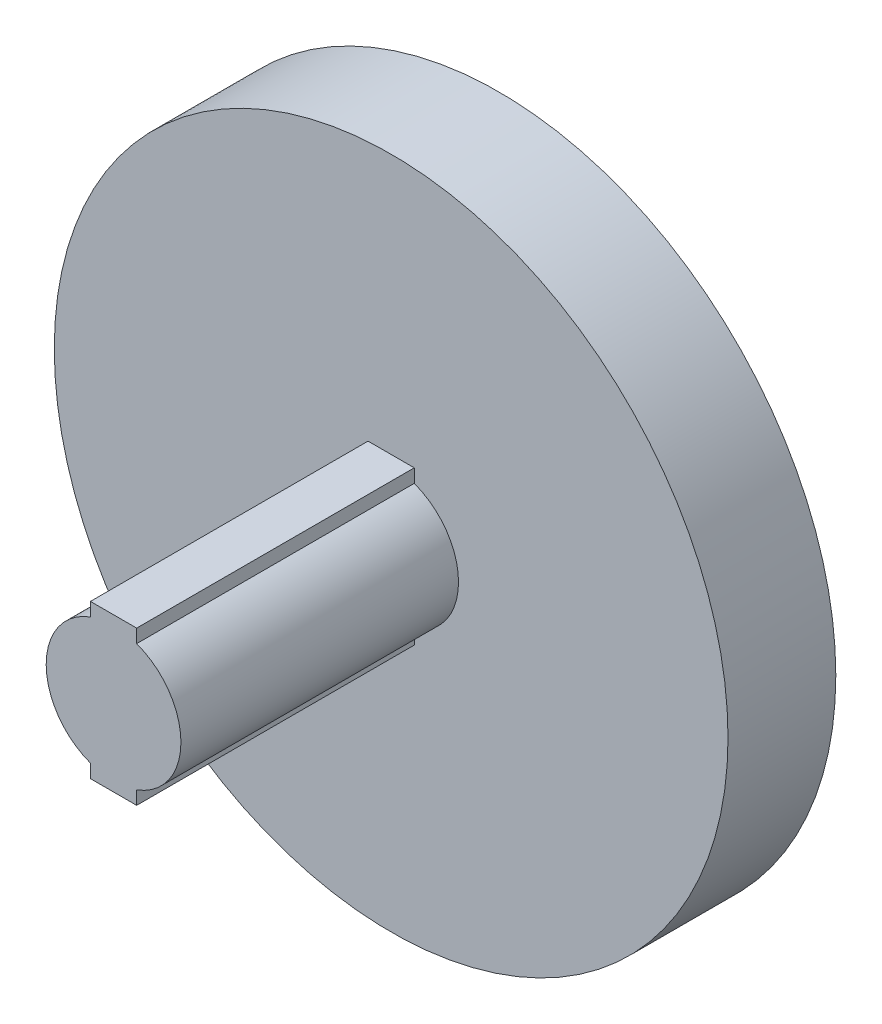
from build123d import *

# Parameters (mm, degrees)
SKETCH1_R           = 25
BOSS_EXTRUDE1_DEPTH = 8
BOSS_EXTRUDE2_DEPTH = 20.6


with BuildPart() as part:
    # Sketch1 → Boss-Extrude1 (new body)
    with BuildSketch(Plane(origin=(0, 0, 0), x_dir=(0, 1, 0), z_dir=(0, 0, 1))):
        with Locations(Location((0, 0, 0), (0, 0, 270))):
            Circle(SKETCH1_R)
    extrude(amount=BOSS_EXTRUDE1_DEPTH)

    # Sketch2 → Boss-Extrude2 (add)
    with BuildSketch(Plane.XY.offset(8)):
        with BuildLine():
            Line((-1.715143801, 4.696624505), (-1.715143801, 5.696624505))
            Line((-1.715143801, 5.696624505), (1.715143801, 5.696624505))
            Line((1.715143801, 5.696624505), (1.715143801, 4.696624505))
            ThreePointArc((1.715143801, 4.696624505), (5, 0), (1.715143801, -4.696624505))
            Line((1.715143801, -4.696624505), (1.715143801, -5.696624505))
            Line((1.715143801, -5.696624505), (-1.715143801, -5.696624505))
            Line((-1.715143801, -5.696624505), (-1.715143801, -4.696624505))
            ThreePointArc((-1.715143801, -4.696624505), (-5, 0), (-1.715143801, 4.696624505))
        make_face()
    extrude(amount=BOSS_EXTRUDE2_DEPTH)


solid = part.part
